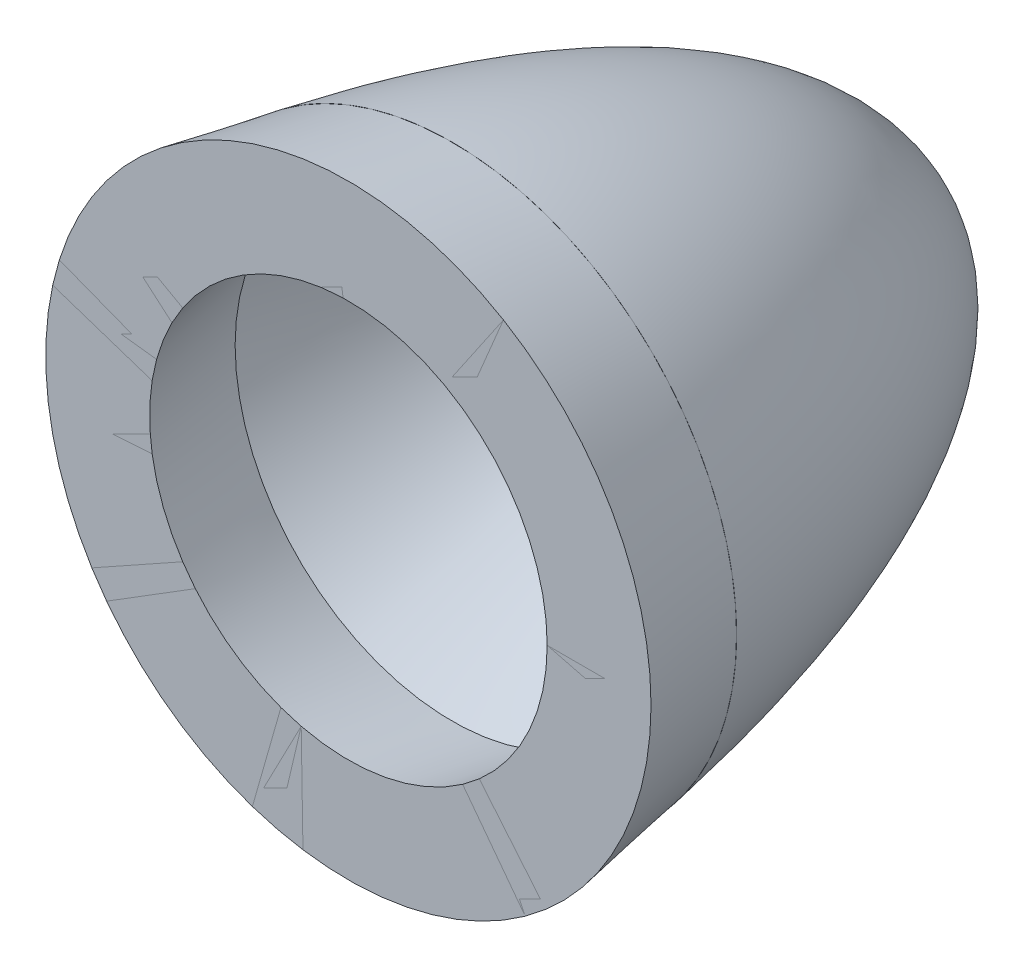
from build123d import *

# Parameters (mm, degrees)
SKETCH_1_3_R    = 29.142907565
SKETCH_1_3_R_2  = 19.142907565
EXTRUDE_1_DEPTH = 10
EXTRUDE_1_DRAFT = -10


with BuildPart() as part:
    # Эскиз1<3> → Бобышка-Вытянуть1 (with draft: the straight prism first)
    with BuildSketch(Plane.XY):
        Circle(SKETCH_1_3_R)
        Circle(SKETCH_1_3_R_2, mode=Mode.SUBTRACT)
    extrude(amount=-EXTRUDE_1_DEPTH)
    # Бобышка-Вытянуть1: the draft: its side faces are tilted about the plane it starts from
    extrude_1_sides = [part.faces().sort_by_distance(p)[0] for p in [
        (-29.142907565, 0, -5),
        (-19.142907565, 0, -5),
    ]]
    draft(extrude_1_sides, Plane.XY, EXTRUDE_1_DRAFT)


solid = part.part
